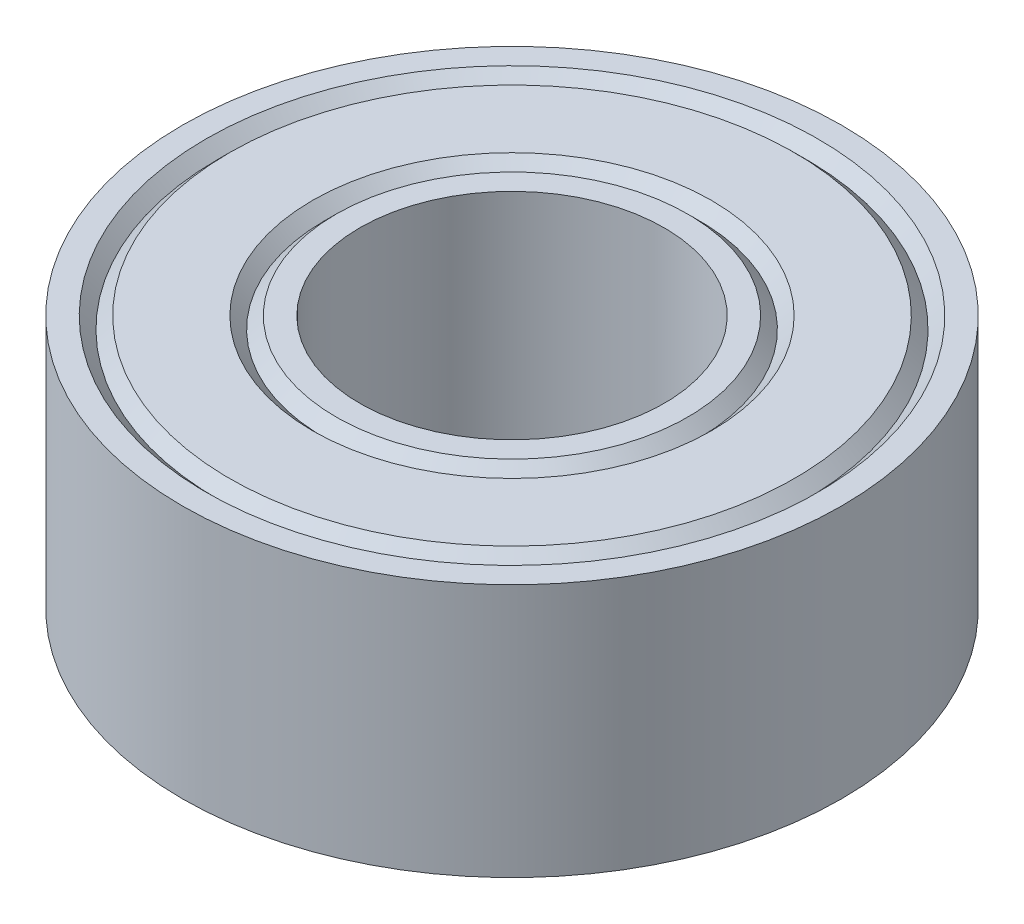
from build123d import *


with BuildPart() as part:
    # Sketch1 → Revolve1 (revolve)
    with BuildSketch(Plane.XY):
        Polygon((-3, 2.5), (-3.466666667, 2.5), (-3.7, 2.266666667), (-3.933333333, 2.5), (-5.566666667, 2.5), (-5.8, 2.266666667), (-6.033333333, 2.5), (-6.5, 2.5), (-6.5, -2.5), (-6.033333333, -2.5), (-5.8, -2.266666667), (-5.566666667, -2.5), (-3.933333333, -2.5), (-3.7, -2.266666667), (-3.466666667, -2.5), (-3, -2.5), align=None)
    revolve(axis=Axis((0, 2.5, 0), (0, -1, 0)))


solid = part.part
